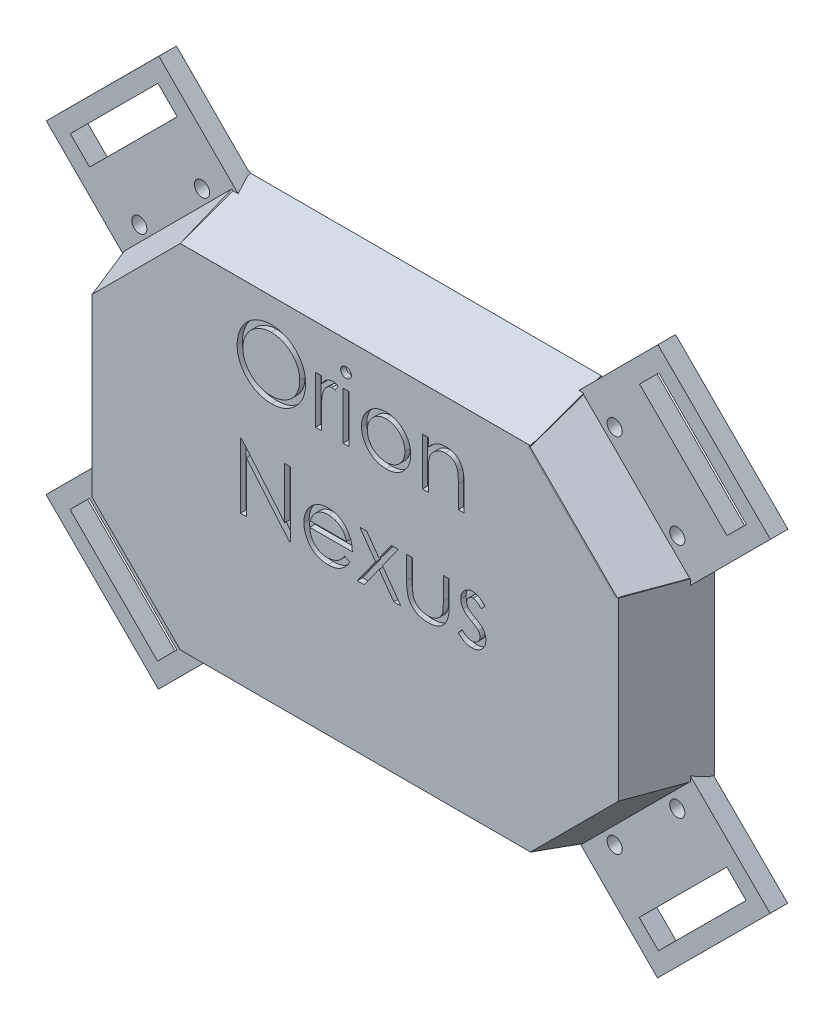
from build123d import *

# Parameters (mm, degrees)
SALIENTE_EXTRUIR1_DEPTH    = 3
CROQUIS2_W                 = 50.038273026
CROQUIS2_H                 = 34.567333251
SALIENTE_EXTRUIR2_DEPTH    = 3
CROQUIS3_W                 = 49.977474859
CROQUIS3_H                 = 25
SALIENTE_EXTRUIR3_DEPTH    = 3
CROQUIS4_W                 = 99.474594081
CROQUIS4_H                 = 31.186701584
SALIENTE_EXTRUIR4_DEPTH    = 3
CROQUIS5_W                 = 99.622543755
CROQUIS5_H                 = 50.308042672
SALIENTE_EXTRUIR5_DEPTH    = 3
SALIENTE_EXTRUIR6_DEPTH    = 3
SALIENTE_EXTRUIR7_DEPTH    = 3
SALIENTE_EXTRUIR8_DEPTH    = 3
SALIENTE_EXTRUIR9_DEPTH    = 3
CORTAR_EXTRUIR1_DEPTH      = 150.019877343
CORTAR_EXTRUIR1_DEPTH_BACK = 150.019877343
CROQUIS13_W                = 256.442645524
CROQUIS13_H                = 67.258268035
SALIENTE_EXTRUIR12_DEPTH   = 5
SALIENTE_EXTRUIR14_DEPTH   = 15
CROQUIS16_W                = 1.66025641
CROQUIS16_H                = 13.519230769
CORTAR_EXTRUIR2_DEPTH      = 1.5
CROQUIS17_R                = 2.15
CORTAR_EXTRUIR3_DEPTH      = 13


with BuildPart() as part:
    # Croquis1 → Saliente-Extruir1 (new body)
    with BuildSketch(Plane.XY):
        Polygon((-75, 25), (-100, 0), (-100, -50), (-75, -75), (24.508620324, -75), (49.508620324, -50), (49.508620324, 0), (24.508620324, 25), align=None)
    extrude(amount=SALIENTE_EXTRUIR1_DEPTH)

    # Croquis4 → Saliente-Extruir4 (add)
    with BuildSketch(Plane(origin=(0, -67.190848031, 24.455468699), x_dir=(1, 0, 0), z_dir=(0, 0.9396926207859093, -0.34202014332566644))):
        with Locations((-25.262702959, 38.425970686)):
            Rectangle(CROQUIS4_W, CROQUIS4_H)
    extrude(amount=SALIENTE_EXTRUIR4_DEPTH)

    # Croquis5 → Saliente-Extruir5 (add)
    with BuildSketch(Plane(origin=(0, 23.039736954, 8.385778456), x_dir=(-1, 0, 0), z_dir=(0, -0.9396926207859094, -0.3420201433256664))):
        with Locations((25.18894197, 30.896712272)):
            Rectangle(CROQUIS5_W, CROQUIS5_H)
    extrude(amount=SALIENTE_EXTRUIR5_DEPTH)



with BuildPart() as body_2:
    # Croquis2 → Saliente-Extruir2 (new body)
    with BuildSketch(Plane(origin=(-89.26640357, 0, 32.49031382), x_dir=(0, -1, 0), z_dir=(0.9396926207859105, 0, -0.3420201433256631))):
        with Locations((24.9777661, 48.666466498)):
            Rectangle(CROQUIS2_W, CROQUIS2_H)
    extrude(amount=SALIENTE_EXTRUIR2_DEPTH)


with BuildPart() as body_3:
    # Croquis3 → Saliente-Extruir3 (new body)
    with BuildSketch(Plane(origin=(44.681393319, 0, 16.262697194), x_dir=(0, 1, 0), z_dir=(-0.9396926207859093, 0, -0.34202014332566644))):
        with Locations((-25.005108127, 26.627091825)):
            Rectangle(CROQUIS3_W, CROQUIS3_H)
    extrude(amount=SALIENTE_EXTRUIR3_DEPTH)


with BuildPart() as part_1:
    add(part.part)

    add(body_3.part)  # Saliente-Extruir6 merges body 3
    # Croquis6 → Saliente-Extruir6 (add)
    with BuildSketch(Plane(origin=(23.835559633, 23.835559633, 8.285857797), x_dir=(-0.7071067811865475, 0.7071067811865477, 0), z_dir=(-0.6866661860794172, -0.686666186079417, -0.2387029488512759))):
        Polygon((-34.804780636, 5.258552546), (0.359891536, 5.258552546), (12.071286835, 54.417017189), (-47.231457067, 54.417017189), align=None)
    extrude(amount=SALIENTE_EXTRUIR6_DEPTH)


    add(body_2.part)  # Saliente-Extruir7 merges body 2
    # Croquis10 → Saliente-Extruir7 (add)
    with BuildSketch(Plane(origin=(-69.863867864, -69.863867864, 28.331140747), x_dir=(0.7071067811865479, -0.7071067811865472, 0), z_dir=(0.6797146636928673, 0.6797146636928679, -0.27563735581699333))):
        Polygon((0, 26.352162728), (-35.355339059, 26.351971429), (-44.361094067, 60.231991098), (6.839722093, 57.835860214), align=None)
    extrude(amount=SALIENTE_EXTRUIR7_DEPTH)

    # Croquis11 → Saliente-Extruir8 (add)
    with BuildSketch(Plane(origin=(47.260978809, -47.260978809, 16.924803418), x_dir=(0.707106781186548, 0.707106781186547, 0), z_dir=(-0.6854710962377859, 0.6854710962377868, -0.24547658227443042))):
        Polygon((-0.347457901, 14.364315254), (-35.818634684, 14.364315254), (-43.289922335, 45.059761782), (6.865850317, 43.729656232), align=None)
    extrude(amount=SALIENTE_EXTRUIR8_DEPTH)

    # Croquis12 → Saliente-Extruir9 (add)
    with BuildSketch(Plane(origin=(-46.763266662, 46.763266662, 18.963403117), x_dir=(-0.7071067811865475, -0.7071067811865476, 0), z_dir=(0.6797146636928684, -0.6797146636928683, -0.27563735581698984))):
        Polygon((35.355339059, 16.606719257), (70.710113301, 16.606719257), (79.338866447, 50.221138178), (27.719892373, 47.881125753), align=None)
    extrude(amount=SALIENTE_EXTRUIR9_DEPTH)

    # Croquis13 → Cortar-Extruir1 (cut, two sides: drawn at the far end of the back side and taken through both)
    with BuildSketch(Plane(origin=(0, 0, 0), x_dir=(1, 0, 0), z_dir=(0, 1, 0)).offset(-CORTAR_EXTRUIR1_DEPTH_BACK)):
        with Locations((-25.283398591, 50.639719858)):
            Rectangle(CROQUIS13_W, CROQUIS13_H)
    extrude(amount=CORTAR_EXTRUIR1_DEPTH + CORTAR_EXTRUIR1_DEPTH_BACK, mode=Mode.SUBTRACT)

    # Croquis14 → Saliente-Extruir12 (add)
    with BuildSketch(Plane(origin=(0, 0, -17.01058584), x_dir=(-1, 0, 0), z_dir=(0, 0, -1))):
        Polygon((-68.902544934, 12.248475653), (-54.691183552, -1.962885728), (-22.754069732, 29.974228091), (-36.965431114, 44.185589473), (-40.50096502, 40.650055567), (-65.367011028, 15.784009559), align=None)
        Polygon((-74.388919269, 17.734849988), (-68.902544934, 12.248475653), (-65.367011028, 15.784009559), (-70.853385363, 21.270383894), align=None)
        Polygon((-77.672153941, 21.01808466), (-74.388919269, 17.734849988), (-70.853385363, 21.270383894), (-45.987339355, 46.136429902), (-42.451805449, 49.671963808), (-45.735040121, 52.95519848), align=None)
        Polygon((-40.50096502, 40.650055567), (-36.965431114, 44.185589473), (-42.451805449, 49.671963808), (-45.987339355, 46.136429902), align=None)
        Polygon((-36.856121932, -94.165082735), (-22.667234726, -79.931282663), (-54.48883101, -48.107086911), (-68.800089251, -62.321910363), (-65.302545844, -65.808417737), (-40.397238185, -90.635140004), align=None)
        Polygon((-65.302545844, -65.808417737), (-68.800089251, -62.321910363), (-74.305047011, -67.78977359), (-70.7802439, -71.303454652), align=None)
        Polygon((-45.611862476, -102.948538307), (-42.333819988, -99.66011965), (-45.874936241, -96.13017692), (-70.7802439, -71.303454652), (-74.305047011, -67.78977359), (-77.599402642, -71.061930579), align=None)
        Polygon((-42.333819988, -99.66011965), (-36.856121932, -94.165082735), (-40.397238185, -90.635140004), (-45.874936241, -96.13017692), align=None)
        Polygon((124.85296704, -67.587015256), (119.364988054, -62.10224604), (115.83048852, -65.638814016), (121.318467506, -71.123583232), align=None)
        Polygon((128.137161989, -70.869289369), (124.85296704, -67.587015256), (121.318467506, -71.123583232), (96.459696427, -95.99690204), (92.925196893, -99.533470016), (96.209391843, -102.815744129), align=None)
        Polygon((119.364988054, -62.10224604), (105.563480713, -48.308810826), (73.635710567, -80.255265587), (87.437217907, -94.0487008), (90.971717441, -90.512132824), (115.83048852, -65.638814016), align=None)
        Polygon((90.971717441, -90.512132824), (87.437217907, -94.0487008), (92.925196893, -99.533470016), (96.459696427, -95.99690204), align=None)
        Polygon((115.7660652, 15.900627883), (90.868020967, 40.734634437), (87.327937452, 44.265612871), (73.454458012, 30.356358881), (105.432669276, -1.539604541), (119.306148716, 12.369649449), align=None)
        Polygon((90.868020967, 40.734634437), (96.347326208, 46.228068771), (92.807242692, 49.759047205), (87.327937452, 44.265612871), align=None)
        Polygon((92.807242692, 49.759047205), (96.347326208, 46.228068771), (121.245370441, 21.394062216), (124.785453956, 17.863083782), (128.064458239, 21.150543399), (96.086246975, 53.046506822), align=None)
        Polygon((124.785453956, 17.863083782), (121.245370441, 21.394062216), (115.7660652, 15.900627883), (119.306148716, 12.369649449), align=None)
    extrude(amount=-SALIENTE_EXTRUIR12_DEPTH)

    # Croquis15 → Saliente-Extruir14 (add)
    with BuildSketch(Plane(origin=(0, 0, 0), x_dir=(-1, 0, 0), z_dir=(0, 0, -1))):
        Polygon((-28.428709003, 2.96132495), (4.562729369, 2.96132495), (3.054172626, 1.46132495), (-26.928709003, 1.46132495), (-26.928709003, -51.538672285), (3.071290997, -51.538672285), (4.547743041, -53.023546743), (-28.428709003, -53.023546743), align=None)
        Polygon((13.391926591, 3.12417932), (46.647662879, 3.12417932), (46.647662879, -52.87582068), (13.383418383, -52.87582068), (9.883418383, -51.37582068), (44.883418383, -51.37582068), (44.883418383, 1.62417932), (14.883418383, 1.62417932), align=None)
    extrude(amount=SALIENTE_EXTRUIR14_DEPTH)

    # Croquis16 → Cortar-Extruir2 (cut)
    # profile 1 of 11: a face of its own
    with BuildSketch(Plane.XY.offset(3)):
        with BuildLine():
            add(Edge.make_bspline(
                [(-49.22416311, 17.984741554), (-48.881605979, 17.976065163), (-48.208795511, 17.959024015), (-47.219971051, 17.828577325), (-46.275968405, 17.602901692), (-45.369097671, 17.302340213), (-44.510206224, 16.901395605), (-43.692829221, 16.416774106), (-42.918911459, 15.843398539), (-42.198884156, 15.185701197), (-41.539983134, 14.47010294), (-40.959474878, 13.706433987), (-40.472965611, 12.899311746), (-40.073440736, 12.051161642), (-39.760005227, 11.163901811), (-39.543718854, 10.232802082), (-39.40556006, 9.263895292), (-39.389408094, 8.603039007), (-39.381214392, 8.267794438)],
                knots=[0, 0, 0, 0, 1.065120563, 2.091984664, 3.0946048, 4.079830382, 5.057816894, 6.036188127, 7.030412546, 8.04752943, 9.064399622, 10.05169764, 11.02544977, 11.989514704, 12.962713494, 13.945757189, 14.957906945, 16, 16, 16, 16], degree=3))
            add(Edge.make_bspline(
                [(-39.381214392, 8.267794438), (-39.389406893, 7.935019365), (-39.40555526, 7.279081142), (-39.543875942, 6.316322937), (-39.760806941, 5.390843542), (-40.070530063, 4.504187949), (-40.468150449, 3.655420826), (-40.957899211, 2.846775498), (-41.534788467, 2.077986864), (-42.191310394, 1.357477062), (-42.907001616, 0.696776145), (-43.674647312, 0.121062088), (-44.476983432, -0.374336856), (-45.324334746, -0.76962199), (-46.205463513, -1.085559284), (-47.128255792, -1.300966042), (-48.088387577, -1.439911843), (-48.743134312, -1.455866855), (-49.075925931, -1.463976395)],
                knots=[0, 0, 0, 0, 1.043624062, 2.057103931, 3.04512605, 4.022047818, 4.998200453, 5.980619268, 6.982898556, 8.009068085, 9.034988726, 10.034168286, 11.015286542, 11.987931943, 12.962482838, 13.94673481, 14.956375938, 16, 16, 16, 16], degree=3))
            add(Edge.make_bspline(
                [(-49.075925931, -1.463976395), (-49.41116876, -1.455786779), (-50.072021615, -1.439642865), (-51.042145945, -1.30125544), (-51.973899734, -1.084851405), (-52.864618448, -0.775587243), (-53.71479879, -0.375896166), (-54.526103513, 0.111469838), (-55.295276148, 0.689764727), (-56.015939665, 1.346073764), (-56.675328284, 2.060551967), (-57.25019927, 2.826104459), (-57.737674869, 3.627711872), (-58.136023912, 4.467598785), (-58.451393197, 5.341704983), (-58.666547236, 6.255861221), (-58.805751554, 7.204855751), (-58.821792885, 7.850996785), (-58.829932341, 8.178852131)],
                knots=[0, 0, 0, 0, 1.053102029, 2.075944431, 3.073151272, 4.055350789, 5.033113405, 6.020478099, 7.024410459, 8.052272461, 9.079885166, 10.07527673, 11.055994387, 12.023226415, 12.992069828, 13.970394897, 14.97016774, 16, 16, 16, 16], degree=3))
            add(Edge.make_bspline(
                [(-58.829932341, 8.178852131), (-58.82710641, 8.398910525), (-58.8214902, 8.836251177), (-58.753876968, 9.485688921), (-58.655765119, 10.124682398), (-58.51515501, 10.751414551), (-58.331256199, 11.364351185), (-58.114266911, 11.967719503), (-57.849242014, 12.5554049), (-57.549644303, 13.130191399), (-57.215260461, 13.683118901), (-56.845917213, 14.205768126), (-56.454587409, 14.702524823), (-56.0255809, 15.160516129), (-55.573036832, 15.593065456), (-55.089613976, 15.993525532), (-54.578262113, 16.365507415), (-54.036780963, 16.700729218), (-53.478512939, 17.003913215), (-52.903021399, 17.264085856), (-52.318122378, 17.487386467), (-51.721076382, 17.668373686), (-51.113468872, 17.811257305), (-50.493973725, 17.908553317), (-49.863084472, 17.976338998), (-49.438053215, 17.981928651), (-49.22416311, 17.984741554)],
                knots=[0, 0, 0, 0, 1.037015668, 2.060948919, 3.074880161, 4.083647147, 5.086022904, 6.090072063, 7.104153813, 8.122640571, 9.144368836, 10.147691507, 11.138137339, 12.123020368, 13.103399296, 14.087645067, 15.080126199, 16.082011238, 17.087798457, 18.072939717, 19.057185487, 20.037253025, 21.01195951, 21.997135196, 22.992090687, 24, 24, 24, 24], degree=3))
        make_face()
        with BuildLine():
            add(Edge.make_bspline(
                [(-49.142632662, 16.087305656), (-49.318195725, 16.085165522), (-49.667643456, 16.080905713), (-50.187147433, 16.024794074), (-50.699819083, 15.944821804), (-51.205764283, 15.830748051), (-51.702866099, 15.675326629), (-52.195758116, 15.496453257), (-52.679945687, 15.27857035), (-53.153830364, 15.032400341), (-53.613238618, 14.759927474), (-54.046734326, 14.458790991), (-54.45543973, 14.136052919), (-54.838354139, 13.790960064), (-55.194353192, 13.421755026), (-55.530443757, 13.034035006), (-55.833154403, 12.616717868), (-56.110578166, 12.181120003), (-56.35883675, 11.727808788), (-56.579596483, 11.261556659), (-56.760177672, 10.778560315), (-56.907450232, 10.284059768), (-57.029549232, 9.778838195), (-57.106899974, 9.259062994), (-57.16362816, 8.727345973), (-57.167644486, 8.368013316), (-57.169675931, 8.18626399)],
                knots=[0, 0, 0, 0, 1.008559885, 2.007477868, 2.99961109, 3.989939068, 4.984837346, 5.991145699, 7.001802488, 8.033829008, 9.059044045, 10.069351652, 11.065060232, 12.050310815, 13.029377138, 14.011219647, 14.996725999, 15.989392538, 16.977580475, 17.965360261, 18.951710183, 19.937753436, 20.929683414, 21.935841486, 22.955955122, 24, 24, 24, 24], degree=3))
            add(Edge.make_bspline(
                [(-57.169675931, 8.18626399), (-57.162937375, 7.919006537), (-57.14968055, 7.393228448), (-57.033619108, 6.622739688), (-56.854845815, 5.882273031), (-56.591314021, 5.175880082), (-56.261746486, 4.497488873), (-55.854604352, 3.853117462), (-55.372234899, 3.242591698), (-54.824299116, 2.670173848), (-54.225307667, 2.147703168), (-53.589263237, 1.68909658), (-52.922979883, 1.301070973), (-52.224720098, 0.984958448), (-51.498211677, 0.734469834), (-50.738773193, 0.562797069), (-49.951463621, 0.449812519), (-49.414801586, 0.438962238), (-49.142632662, 0.433459502)],
                knots=[0, 0, 0, 0, 1.032063989, 2.030389145, 3.003944642, 3.970395727, 4.937377036, 5.913328081, 6.909231446, 7.93887556, 8.970685674, 9.976071282, 10.964166581, 11.944589148, 12.933237628, 13.927779006, 14.949070134, 16, 16, 16, 16], degree=3))
            add(Edge.make_bspline(
                [(-49.142632662, 0.433459502), (-48.959696724, 0.435972883), (-48.596879818, 0.44095767), (-48.057232057, 0.491164962), (-47.527306366, 0.571676272), (-47.00784603, 0.687595452), (-46.499440598, 0.832673543), (-45.999968067, 1.005028676), (-45.514748533, 1.220057896), (-45.037660819, 1.457639926), (-44.58099497, 1.728480758), (-44.145052871, 2.019396692), (-43.740822691, 2.341659402), (-43.358194742, 2.681624982), (-43.000734101, 3.046148178), (-42.670858041, 3.434755065), (-42.369677343, 3.849898539), (-42.092358925, 4.284835683), (-41.84497025, 4.739387305), (-41.629423584, 5.207329888), (-41.4465584, 5.687511181), (-41.298936303, 6.180623773), (-41.183256006, 6.685731116), (-41.103547858, 7.203509529), (-41.047791825, 7.732923197), (-41.043589274, 8.090997864), (-41.041470803, 8.271500368)],
                knots=[0, 0, 0, 0, 1.047197238, 2.076906641, 3.100256066, 4.114471768, 5.12198147, 6.126382909, 7.136867548, 8.15857795, 9.17633901, 10.174870724, 11.156907918, 12.133735059, 13.104061851, 14.077631395, 15.04955518, 16.038496417, 17.029181396, 18.010275684, 18.986308667, 19.968651475, 20.955262928, 21.950658345, 22.966943676, 24, 24, 24, 24], degree=3))
            add(Edge.make_bspline(
                [(-41.041470803, 8.271500368), (-41.043590971, 8.450768033), (-41.047796716, 8.80637847), (-41.103521225, 9.332099938), (-41.183340217, 9.846152627), (-41.298371674, 10.346518443), (-41.446636772, 10.833324933), (-41.629455518, 11.306114885), (-41.845034958, 11.766649631), (-42.092449859, 12.213790915), (-42.370562068, 12.642857387), (-42.674460212, 13.053041567), (-43.009391338, 13.436640343), (-43.36578604, 13.803123726), (-43.752546434, 14.144675428), (-44.16792056, 14.461408751), (-44.606865714, 14.760967487), (-45.071623958, 15.031202599), (-45.551270571, 15.280763544), (-46.043444349, 15.494575989), (-46.54256959, 15.676257191), (-47.047377041, 15.831218292), (-47.56211564, 15.944375023), (-48.083307307, 16.024866144), (-48.61023096, 16.080886184), (-48.964602264, 16.085159042), (-49.142632662, 16.087305656)],
                knots=[0, 0, 0, 0, 1.02996197, 2.043119294, 3.035359645, 4.018872909, 4.991431989, 5.957985074, 6.929999688, 7.912076566, 8.892894881, 9.867085534, 10.843653904, 11.817741046, 12.803660682, 13.806313499, 14.818574707, 15.856120519, 16.894564902, 17.924820532, 18.937903209, 19.946497019, 20.957711757, 21.963978472, 22.977135795, 24, 24, 24, 24], degree=3))
        make_face(mode=Mode.SUBTRACT)
    # profile 2 of 11: a face of its own
    with BuildSketch(Plane.XY.offset(3)):
        with BuildLine():
            Line((-36.535060546, 12.529613348), (-34.874804136, 12.529613348))
            Line((-34.874804136, 12.529613348), (-34.874804136, 10.539529214))
            add(Edge.make_bspline(
                [(-34.874804136, 10.539529214), (-34.752234982, 10.724824306), (-34.517822429, 11.079199731), (-34.128196945, 11.547880322), (-33.729107908, 11.935931283), (-33.318644776, 12.245164168), (-32.893789105, 12.476747796), (-32.463865217, 12.64638241), (-32.022109162, 12.746691076), (-31.725253277, 12.760083273), (-31.576526892, 12.766792836)],
                knots=[0, 0, 0, 0, 1.2804753, 2.448899062, 3.506932113, 4.484331642, 5.4025378, 6.288909075, 7.142734305, 8, 8, 8, 8], degree=3))
            add(Edge.make_bspline(
                [(-31.576526892, 12.766792836), (-31.461159167, 12.760500052), (-31.223782573, 12.747552241), (-30.864446027, 12.65658074), (-30.494216353, 12.511339763), (-30.255606592, 12.374755729), (-30.131214392, 12.30355165)],
                knots=[0, 0, 0, 0, 0.901110191, 1.854092781, 2.881294221, 4, 4, 4, 4], degree=3))
            Line((-30.131214392, 12.30355165), (-31.042873046, 10.865651009))
            add(Edge.make_bspline(
                [(-31.042873046, 10.865651009), (-31.122735015, 10.90127813), (-31.27432832, 10.968905225), (-31.496088171, 11.048941565), (-31.700546665, 11.096068548), (-31.830805473, 11.103208055), (-31.891530899, 11.106536425)],
                knots=[0, 0, 0, 0, 1.180555205, 2.24091978, 3.179933427, 4, 4, 4, 4], degree=3))
            add(Edge.make_bspline(
                [(-31.891530899, 11.106536425), (-32.024761204, 11.097656228), (-32.296512409, 11.079543199), (-32.695501905, 10.937152358), (-33.082665706, 10.707090375), (-33.390144493, 10.451943069), (-33.628224972, 10.205904711), (-33.798109021, 9.991048869), (-33.953946398, 9.750133245), (-34.102846134, 9.487276345), (-34.238510832, 9.197990016), (-34.36512837, 8.885164459), (-34.479610931, 8.54843735), (-34.544890793, 8.313844029), (-34.578329777, 8.193675848)],
                knots=[0, 0, 0, 0, 1.125678352, 2.296057538, 3.5422874, 4.923748041, 5.663163013, 6.437101912, 7.23742474, 8.08941207, 8.991984279, 9.93940061, 10.944477711, 12, 12, 12, 12], degree=3))
            add(Edge.make_bspline(
                [(-34.578329777, 8.193675848), (-34.603343856, 8.086496502), (-34.658748141, 7.849102395), (-34.712617698, 7.450831622), (-34.765842293, 6.980277997), (-34.80335299, 6.43613172), (-34.838122641, 5.819751659), (-34.857733076, 5.130198804), (-34.87413539, 4.366765377), (-34.874574458, 3.833043795), (-34.874804136, 3.553852131)],
                knots=[0, 0, 0, 0, 0.566838948, 1.255505196, 2.06880316, 3.007127437, 4.065329342, 5.249902469, 6.561414163, 8, 8, 8, 8], degree=3))
            Line((-34.874804136, 3.553852131), (-34.874804136, -0.989617421))
            Line((-34.874804136, -0.989617421), (-36.535060546, -0.989617421))
            Line((-36.535060546, -0.989617421), (-36.535060546, 12.529613348))
        make_face()
    # profile 3 of 11: a face of its own
    with BuildSketch(Plane.XY.offset(3)):
        with BuildLine():
            add(Edge.make_bspline(
                [(-27.885421123, 18.221921041), (-27.782395597, 18.21714195), (-27.580651829, 18.207783571), (-27.288915986, 18.127644335), (-27.023271779, 17.991803141), (-26.787646619, 17.809553399), (-26.585458075, 17.595220626), (-26.443902892, 17.345412651), (-26.352923084, 17.075531274), (-26.341936435, 16.887280089), (-26.336342597, 16.791432259)],
                knots=[0, 0, 0, 0, 1.055194115, 2.066272739, 3.074728998, 4.095836921, 5.109056067, 6.073838105, 7.019297344, 8, 8, 8, 8], degree=3))
            add(Edge.make_bspline(
                [(-26.336342597, 16.791432259), (-26.342062585, 16.698072521), (-26.353370324, 16.513511367), (-26.443832619, 16.248308729), (-26.586664447, 16.001971802), (-26.787516969, 15.788055191), (-27.023306134, 15.605906199), (-27.288906859, 15.470038294), (-27.58065423, 15.389906139), (-27.782396408, 15.380546784), (-27.885421123, 15.375767195)],
                knots=[0, 0, 0, 0, 0.96129708, 1.900370562, 2.859976407, 3.87933698, 4.906634145, 5.921202961, 6.938410037, 8, 8, 8, 8], degree=3))
            add(Edge.make_bspline(
                [(-27.885421123, 15.375767195), (-27.98726772, 15.380364287), (-28.185498816, 15.389311927), (-28.472866411, 15.471610593), (-28.736245569, 15.605952693), (-28.972330267, 15.786862529), (-29.169118431, 16.003285557), (-29.312352437, 16.248158396), (-29.402605807, 16.513549642), (-29.413941701, 16.698085378), (-29.419675931, 16.791432259)],
                knots=[0, 0, 0, 0, 1.054934014, 2.053291228, 3.073705704, 4.106921865, 5.123545215, 6.088680038, 7.033164197, 8, 8, 8, 8], degree=3))
            add(Edge.make_bspline(
                [(-29.419675931, 16.791432259), (-29.41406733, 16.88726675), (-29.403051684, 17.075491736), (-29.312284785, 17.345565482), (-29.170311515, 17.593896277), (-28.972199965, 17.810745345), (-28.736280247, 17.991756929), (-28.472857451, 18.126072117), (-28.185501183, 18.208377768), (-27.987268524, 18.217324444), (-27.885421123, 18.221921041)],
                knots=[0, 0, 0, 0, 0.98631895, 1.937192651, 2.907499808, 3.917963147, 4.944918757, 5.95915025, 6.951458133, 8, 8, 8, 8], degree=3))
        make_face()
    # profile 4 of 11: a face of its own
    with BuildSketch(Plane.XY.offset(3)):
        with Locations((-27.878009264, 5.769997964)):
            Rectangle(CROQUIS16_W, CROQUIS16_H)
    # profile 5 of 11: a face of its own
    with BuildSketch(Plane.XY.offset(3)):
        with BuildLine():
            add(Edge.make_bspline(
                [(-16.485982021, 12.766792836), (-16.232313864, 12.761391411), (-15.734932603, 12.750800537), (-15.006519492, 12.637607148), (-14.311209487, 12.464513936), (-13.646339614, 12.225221393), (-13.02042491, 11.904473941), (-12.424348334, 11.521739116), (-11.859744144, 11.068316836), (-11.521336704, 10.717567046), (-11.349563751, 10.539529214)],
                knots=[0, 0, 0, 0, 1.054011418, 2.066658804, 3.057071809, 4.030435133, 4.997543892, 5.974964718, 6.972108034, 8, 8, 8, 8], degree=3))
            add(Edge.make_bspline(
                [(-11.349563751, 10.539529214), (-11.201659137, 10.369255289), (-10.90871227, 10.032002709), (-10.533079185, 9.485165897), (-10.20947951, 8.918853937), (-9.950146716, 8.325546639), (-9.745668734, 7.710423377), (-9.600492911, 7.07136989), (-9.51414054, 6.409797483), (-9.502496286, 5.960491482), (-9.496599008, 5.732938669)],
                knots=[0, 0, 0, 0, 1.025258237, 2.030674902, 3.01204498, 3.988269485, 4.97094183, 5.956517959, 6.965070386, 8, 8, 8, 8], degree=3))
            add(Edge.make_bspline(
                [(-9.496599008, 5.732938669), (-9.501786076, 5.504066936), (-9.512035966, 5.051805717), (-9.608995081, 4.385703355), (-9.759802249, 3.739816435), (-9.97562768, 3.116849053), (-10.252377686, 2.514896966), (-10.590085606, 1.936589348), (-10.991121296, 1.380785215), (-11.445713851, 0.85220407), (-11.94813091, 0.365039792), (-12.493173409, -0.05955249), (-13.070130444, -0.423323405), (-13.686673883, -0.716344459), (-14.337173456, -0.947381446), (-15.023032245, -1.109652961), (-15.743184759, -1.207764719), (-16.234900072, -1.220363606), (-16.485982021, -1.226796908)],
                knots=[0, 0, 0, 0, 0.998656419, 1.973391657, 2.932242238, 3.890759089, 4.846373663, 5.82037756, 6.809684879, 7.83454468, 8.860553229, 9.859544525, 10.845671541, 11.83227036, 12.833544569, 13.85385346, 14.904124723, 16, 16, 16, 16], degree=3))
            add(Edge.make_bspline(
                [(-16.485982021, -1.226796908), (-16.738294109, -1.220342014), (-17.232460082, -1.207699777), (-17.955154558, -1.11003414), (-18.642242544, -0.947456232), (-19.293593707, -0.715585199), (-19.912787898, -0.423314039), (-20.493087954, -0.060652251), (-21.038573222, 0.365165712), (-21.541096568, 0.852169951), (-21.995660624, 1.380794006), (-22.396703669, 1.936587066), (-22.734409678, 2.51489756), (-23.011160184, 3.116848895), (-23.226985481, 3.739816477), (-23.377792685, 4.385703343), (-23.474751791, 5.05180572), (-23.485001682, 5.504066937), (-23.490188751, 5.732938669)],
                knots=[0, 0, 0, 0, 1.099876186, 2.154163076, 3.173186993, 4.173200201, 5.163417411, 6.152872554, 7.150605724, 8.17532212, 9.198891216, 10.186952605, 11.159729845, 12.11414092, 13.071450619, 14.029093627, 15.002601286, 16, 16, 16, 16], degree=3))
            add(Edge.make_bspline(
                [(-23.490188751, 5.732938669), (-23.484251254, 5.959254697), (-23.472496029, 6.407321539), (-23.386230481, 7.067650288), (-23.241620968, 7.705622201), (-23.036897873, 8.318371146), (-22.775174721, 8.909078451), (-22.456122199, 9.4767897), (-22.076657427, 10.021153788), (-21.784875683, 10.357970497), (-21.637224008, 10.528411425)],
                knots=[0, 0, 0, 0, 1.031353054, 2.041901799, 3.029428768, 4.008703097, 4.981709435, 5.96992636, 6.972712378, 8, 8, 8, 8], degree=3))
            add(Edge.make_bspline(
                [(-21.637224008, 10.528411425), (-21.465710027, 10.707993247), (-21.128397603, 11.061172499), (-20.5609829, 11.513272983), (-19.966372702, 11.903972231), (-19.33354095, 12.218346512), (-18.669217272, 12.465921535), (-17.970344133, 12.638053543), (-17.239459266, 12.750392705), (-16.739644126, 12.761271645), (-16.485982021, 12.766792836)],
                knots=[0, 0, 0, 0, 1.027980169, 2.021703884, 2.998553061, 3.971491411, 4.943284454, 5.930300938, 6.949603206, 8, 8, 8, 8], degree=3))
        make_face()
        with BuildLine():
            add(Edge.make_bspline(
                [(-16.493393879, 11.106536425), (-16.672778396, 11.101437869), (-17.026916648, 11.091372376), (-17.548191596, 11.014814594), (-18.050018124, 10.893520644), (-18.5333483, 10.721184918), (-18.996552211, 10.498662166), (-19.440073338, 10.225346548), (-19.865216235, 9.904858064), (-20.263664284, 9.537698228), (-20.62934222, 9.136623543), (-20.949011525, 8.709282217), (-21.220829944, 8.262605816), (-21.447270784, 7.796129842), (-21.615923064, 7.305127083), (-21.73840904, 6.795158032), (-21.814894597, 6.265183688), (-21.824865455, 5.90490402), (-21.829932341, 5.721820881)],
                knots=[0, 0, 0, 0, 1.021534396, 2.016698045, 2.994645724, 3.958388632, 4.93408049, 5.916473867, 6.921342795, 7.962252576, 8.998418191, 10.008913653, 10.997312074, 11.973003931, 12.956656626, 13.948281152, 14.957379055, 16, 16, 16, 16], degree=3))
            add(Edge.make_bspline(
                [(-21.829932341, 5.721820881), (-21.82143913, 5.485274451), (-21.804581695, 5.015774022), (-21.667495446, 4.324343802), (-21.438167966, 3.660554013), (-21.128492345, 3.028295972), (-20.740488046, 2.443313931), (-20.283342122, 1.921764657), (-19.761960849, 1.471496796), (-19.182559348, 1.097898041), (-18.556972239, 0.801053618), (-17.894903113, 0.590687604), (-17.20437373, 0.45393723), (-16.732461294, 0.440345151), (-16.493393879, 0.433459502)],
                knots=[0, 0, 0, 0, 1.016792936, 2.018143844, 3.017858371, 4.030088057, 5.03801393, 6.028138512, 7.003788237, 7.991172063, 8.984598303, 9.972568034, 10.972917682, 12, 12, 12, 12], degree=3))
            add(Edge.make_bspline(
                [(-16.493393879, 0.433459502), (-16.254340215, 0.440385269), (-15.782454922, 0.454056541), (-15.092884987, 0.589998874), (-14.432625422, 0.801975367), (-13.807688088, 1.09756419), (-13.228550327, 1.472915525), (-12.703419257, 1.91922209), (-12.250176598, 2.444695304), (-11.862556115, 3.029070814), (-11.547809046, 3.659573818), (-11.31955498, 4.324466314), (-11.182139169, 5.015742821), (-11.165326217, 5.485263998), (-11.156855418, 5.721820881)],
                knots=[0, 0, 0, 0, 1.02726834, 2.027799167, 3.010890988, 4.004497153, 4.992059811, 5.971914811, 6.958719428, 7.966827853, 8.981595046, 9.981490638, 10.983022906, 12, 12, 12, 12], degree=3))
            add(Edge.make_bspline(
                [(-11.156855418, 5.721820881), (-11.16192056, 5.904905114), (-11.171887985, 6.265186936), (-11.248398511, 6.795145619), (-11.370792078, 7.30517263), (-11.539784912, 7.79596179), (-11.765241842, 8.263813598), (-12.042302034, 8.707970727), (-12.360666025, 9.138103899), (-12.730756522, 9.536401715), (-13.128788662, 9.905001194), (-13.554103864, 10.225470823), (-13.996967322, 10.497460971), (-14.458825545, 10.723088243), (-14.942217688, 10.891952756), (-15.443341085, 11.015514951), (-15.962391937, 11.091048847), (-16.315261166, 11.101340881), (-16.493393879, 11.106536425)],
                knots=[0, 0, 0, 0, 1.042956736, 2.052379634, 3.044323526, 4.02829302, 5.004299113, 5.996692471, 7.007513377, 8.048758398, 9.090003419, 10.095195979, 11.07790575, 12.047570684, 13.018257071, 13.989683339, 14.985167495, 16, 16, 16, 16], degree=3))
        make_face(mode=Mode.SUBTRACT)
    # profile 6 of 11: a face of its own
    with BuildSketch(Plane.XY.offset(3)):
        with BuildLine():
            Line((-6.176086187, 12.529613348), (-4.515829777, 12.529613348))
            Line((-4.515829777, 12.529613348), (-4.515829777, 10.091111746))
            add(Edge.make_bspline(
                [(-4.515829777, 10.091111746), (-4.33855942, 10.312280424), (-3.994560107, 10.741465959), (-3.421671488, 11.305560425), (-2.816225158, 11.770413757), (-2.181928854, 12.140962382), (-1.517921515, 12.420294549), (-0.828250659, 12.622028756), (-0.108787213, 12.742991422), (0.380481953, 12.758796925), (0.628000351, 12.766792836)],
                knots=[0, 0, 0, 0, 1.12780773, 2.188550248, 3.19190651, 4.159438251, 5.104880172, 6.052711206, 7.014878035, 8, 8, 8, 8], degree=3))
            add(Edge.make_bspline(
                [(0.628000351, 12.766792836), (0.87817656, 12.757568231), (1.367831747, 12.739513455), (2.080758643, 12.596710945), (2.746618009, 12.352800311), (3.363035661, 12.018679367), (3.918708075, 11.603188008), (4.406710861, 11.119134018), (4.810345169, 10.562357579), (5.080959802, 10.045820896), (5.25922394, 9.587608697), (5.371452009, 9.19516159), (5.466758626, 8.757937076), (5.54938358, 8.277256391), (5.605291171, 7.749751671), (5.64938614, 7.177585299), (5.68098781, 6.560942609), (5.682241618, 6.13445615), (5.682888172, 5.914529214)],
                knots=[0, 0, 0, 0, 1.235846778, 2.418850247, 3.575807741, 4.728682307, 5.871620074, 6.994088408, 8.11269785, 9.256955736, 9.865816715, 10.540099792, 11.271859618, 12.076849838, 12.949306005, 13.892391288, 14.913166135, 16, 16, 16, 16], degree=3))
            Line((5.682888172, 5.914529214), (5.682888172, -0.989617421))
            Line((5.682888172, -0.989617421), (4.022631762, -0.989617421))
            Line((4.022631762, -0.989617421), (4.022631762, 5.369757579))
            add(Edge.make_bspline(
                [(4.022631762, 5.369757579), (4.021610519, 5.553819074), (4.019657056, 5.905897388), (4.013495781, 6.409990796), (3.998643946, 6.867134139), (3.977774292, 7.27623451), (3.947227988, 7.636899075), (3.915394079, 7.949862394), (3.876464916, 8.214727119), (3.841775232, 8.374171126), (3.826217499, 8.445679054)],
                knots=[0, 0, 0, 0, 1.430800155, 2.736877192, 3.918605307, 4.986035426, 5.920637409, 6.731861385, 7.431261377, 8, 8, 8, 8], degree=3))
            add(Edge.make_bspline(
                [(3.826217499, 8.445679054), (3.770053975, 8.655581031), (3.661956569, 9.059577396), (3.394848372, 9.607570402), (3.057544845, 10.073760824), (2.64579907, 10.455266352), (2.163588241, 10.752169346), (1.612250487, 10.958174536), (0.997106243, 11.08702053), (0.564447363, 11.099849656), (0.338937851, 11.106536425)],
                knots=[0, 0, 0, 0, 1.084156227, 2.086665306, 3.027808233, 3.945421172, 4.874247719, 5.839848303, 6.874090471, 8, 8, 8, 8], degree=3))
            add(Edge.make_bspline(
                [(0.338937851, 11.106536425), (0.205380095, 11.104020401), (-0.058927254, 11.099041253), (-0.450862819, 11.049084392), (-0.831033449, 10.967375412), (-1.203254554, 10.857069757), (-1.560081464, 10.705569191), (-1.912978431, 10.533628234), (-2.248657042, 10.319301971), (-2.574274998, 10.080437258), (-2.877214124, 9.815732877), (-3.159092484, 9.536411894), (-3.410364877, 9.238955132), (-3.638013589, 8.928155409), (-3.834527267, 8.599744265), (-4.006065018, 8.256890074), (-4.151610833, 7.899141573), (-4.223933637, 7.650844821), (-4.260120642, 7.526608541)],
                knots=[0, 0, 0, 0, 1.023777757, 2.026029729, 3.023749952, 4.003683103, 4.997618607, 5.993177895, 7.010360494, 8.046726602, 9.087585522, 10.09234134, 11.086953743, 12.070360549, 13.043493632, 14.017870808, 15.008233677, 16, 16, 16, 16], degree=3))
            add(Edge.make_bspline(
                [(-4.260120642, 7.526608541), (-4.280944499, 7.435402468), (-4.326276946, 7.236851617), (-4.375239468, 6.911016829), (-4.419679509, 6.534092675), (-4.456874862, 6.106519), (-4.479632063, 5.626798802), (-4.504445304, 5.096980803), (-4.513478912, 4.514952364), (-4.515024212, 4.10974056), (-4.515829777, 3.898503573)],
                knots=[0, 0, 0, 0, 0.615963638, 1.340920617, 2.168419149, 3.115676021, 4.16674242, 5.331190069, 6.6087489, 8, 8, 8, 8], degree=3))
            Line((-4.515829777, 3.898503573), (-4.515829777, -0.989617421))
            Line((-4.515829777, -0.989617421), (-6.176086187, -0.989617421))
            Line((-6.176086187, -0.989617421), (-6.176086187, 12.529613348))
        make_face()
    # profile 7 of 11: a face of its own
    with BuildSketch(Plane.XY.offset(3)):
        Polygon((-57.881214392, -32.822950754), (-57.881214392, -14.322950754), (-57.532857021, -14.322950754), (-45.310701572, -28.883547709), (-45.310701572, -14.322950754), (-43.650445162, -14.322950754), (-43.650445162, -32.822950754), (-44.028449969, -32.822950754), (-56.220957982, -18.295707164), (-56.220957982, -32.822950754), align=None)
    # profile 8 of 11: a face of its own
    with BuildSketch(Plane.XY.offset(3)):
        with BuildLine():
            Line((-28.285661508, -28.553719985), (-26.810701572, -29.328259248))
            add(Edge.make_bspline(
                [(-26.810701572, -29.328259248), (-26.928237861, -29.536745427), (-27.156916934, -29.942376971), (-27.55017803, -30.499659662), (-27.962421843, -31.000997588), (-28.412257102, -31.43299719), (-28.886225405, -31.809611653), (-29.386955152, -32.139111584), (-29.917053188, -32.419880906), (-30.476544591, -32.656429981), (-31.070127932, -32.838308736), (-31.699241662, -32.966773904), (-32.365090995, -33.046182609), (-32.821492231, -33.055406925), (-33.055192758, -33.060130241)],
                knots=[0, 0, 0, 0, 1.120438281, 2.179929193, 3.190490725, 4.156257408, 5.095198341, 6.022838206, 6.959905092, 7.901321166, 8.864066838, 9.862729781, 10.905609505, 12, 12, 12, 12], degree=3))
            add(Edge.make_bspline(
                [(-33.055192758, -33.060130241), (-33.31494321, -33.0540666), (-33.821641093, -33.042238193), (-34.559208328, -32.940263738), (-35.253642397, -32.773909842), (-35.904904257, -32.541520552), (-36.511399021, -32.237976124), (-37.074332111, -31.868190292), (-37.59666389, -31.43406266), (-38.06193471, -30.931832887), (-38.480795233, -30.394371113), (-38.850403139, -29.834318581), (-39.159392417, -29.253084394), (-39.410741928, -28.654368767), (-39.613739072, -28.04194533), (-39.75522022, -27.410241858), (-39.836777459, -26.760968056), (-39.849275243, -26.321739281), (-39.855573367, -26.100394664)],
                knots=[0, 0, 0, 0, 1.145258523, 2.234067595, 3.276747158, 4.290159414, 5.277019952, 6.260822364, 7.254936242, 8.264827045, 9.274100331, 10.257902744, 11.220704747, 12.172965371, 13.118907548, 14.062713208, 15.023725156, 16, 16, 16, 16], degree=3))
            add(Edge.make_bspline(
                [(-39.855573367, -26.100394664), (-39.849975048, -25.892693418), (-39.83887992, -25.481056976), (-39.768945758, -24.871796241), (-39.645004781, -24.279645849), (-39.474929926, -23.704113766), (-39.25530191, -23.14616363), (-38.986617323, -22.605455865), (-38.668457612, -22.08256584), (-38.422816336, -21.752720705), (-38.299082982, -21.586572549)],
                knots=[0, 0, 0, 0, 1.024358464, 2.0301432, 3.019427413, 4.004406732, 4.986367066, 5.972626655, 6.978780325, 8, 8, 8, 8], degree=3))
            add(Edge.make_bspline(
                [(-38.299082982, -21.586572549), (-38.13148523, -21.386408521), (-37.801598798, -20.992421155), (-37.243658063, -20.474747147), (-36.639499882, -20.041087192), (-35.996695573, -19.681620901), (-35.30777421, -19.408488767), (-34.581996529, -19.20494869), (-33.81109843, -19.090893489), (-33.28408512, -19.074783511), (-33.014427533, -19.066540498)],
                knots=[0, 0, 0, 0, 1.030682036, 2.02871468, 2.997146059, 3.962720338, 4.930598197, 5.918074684, 6.934738563, 8, 8, 8, 8], degree=3))
            add(Edge.make_bspline(
                [(-33.014427533, -19.066540498), (-32.737204477, -19.073697613), (-32.193356034, -19.087738242), (-31.400329108, -19.217906005), (-30.649965321, -19.42432665), (-29.942564941, -19.715853829), (-29.278056249, -20.091982888), (-28.660758558, -20.557875479), (-28.080114849, -21.099228226), (-27.742312361, -21.515548047), (-27.570417117, -21.727397869)],
                knots=[0, 0, 0, 0, 1.056321875, 2.072262726, 3.055038591, 4.01806755, 4.982017516, 5.957941055, 6.960871419, 8, 8, 8, 8], degree=3))
            add(Edge.make_bspline(
                [(-27.570417117, -21.727397869), (-27.453460443, -21.887045371), (-27.220325593, -22.205277713), (-26.928305208, -22.7241824), (-26.67481612, -23.267081256), (-26.47219904, -23.842749969), (-26.308133105, -24.44436775), (-26.189432778, -25.076235487), (-26.119821937, -25.738165018), (-26.106138822, -26.189176811), (-26.09916311, -26.4191046)],
                knots=[0, 0, 0, 0, 0.94817472, 1.890038105, 2.849395472, 3.817997239, 4.812318967, 5.836947057, 6.897266129, 8, 8, 8, 8], degree=3))
            Line((-26.09916311, -26.4191046), (-38.195316956, -26.4191046))
            add(Edge.make_bspline(
                [(-38.195316956, -26.4191046), (-38.187179037, -26.597235626), (-38.171176146, -26.947523102), (-38.096567532, -27.460082956), (-37.978966871, -27.94834205), (-37.813687539, -28.408638129), (-37.613534215, -28.846983089), (-37.368352569, -29.260125284), (-37.075843498, -29.646182915), (-36.749579087, -30.008609213), (-36.386413011, -30.331358951), (-36.004347062, -30.620232625), (-35.597909647, -30.862347922), (-35.170305491, -31.058870197), (-34.722226056, -31.212717867), (-34.253530167, -31.317733491), (-33.765140123, -31.388071056), (-33.432215529, -31.395892143), (-33.262724809, -31.399873831)],
                knots=[0, 0, 0, 0, 1.094153842, 2.151609401, 3.174256925, 4.172055639, 5.149267565, 6.128595816, 7.11444997, 8.118368179, 9.117203808, 10.09244225, 11.054858984, 12.015122123, 12.976791628, 13.957293641, 14.960065497, 16, 16, 16, 16], degree=3))
            add(Edge.make_bspline(
                [(-33.262724809, -31.399873831), (-33.0970116, -31.396659817), (-32.768204805, -31.390282597), (-32.278531702, -31.328271068), (-31.7967942, -31.227999611), (-31.324986146, -31.091152521), (-30.872683103, -30.924246303), (-30.453813767, -30.722845484), (-30.06858977, -30.500053965), (-29.708542947, -30.245231397), (-29.359310553, -29.93333098), (-29.012871697, -29.544113598), (-28.641409386, -29.083793808), (-28.408892967, -28.737338145), (-28.285661508, -28.553719985)],
                knots=[0, 0, 0, 0, 0.99110716, 1.966546729, 2.947904876, 3.932708344, 4.903319531, 5.828989031, 6.710028674, 7.56322171, 8.463672341, 9.504779593, 10.677557249, 12, 12, 12, 12], degree=3))
        make_face()
        with BuildLine():
            add(Edge.make_bspline(
                [(-27.759419521, -24.75884819), (-27.820187393, -24.538630143), (-27.937145987, -24.114781292), (-28.181538199, -23.527850871), (-28.456773485, -23.006214822), (-28.782488351, -22.553865333), (-29.151530187, -22.152132479), (-29.577797581, -21.801062815), (-30.055815875, -21.486999145), (-30.58311419, -21.221907362), (-31.141506482, -20.996260966), (-31.726139211, -20.844956782), (-32.322673233, -20.741306345), (-32.726154461, -20.731654057), (-32.929191155, -20.726796908)],
                knots=[0, 0, 0, 0, 1.154881502, 2.222775134, 3.210006277, 4.132804581, 5.035138423, 5.962687519, 6.919655026, 7.923214229, 8.944639381, 9.960483929, 10.97369054, 12, 12, 12, 12], degree=3))
            add(Edge.make_bspline(
                [(-32.929191155, -20.726796908), (-33.09489533, -20.730030029), (-33.422457647, -20.736421229), (-33.905049007, -20.797049056), (-34.368498844, -20.897265379), (-34.816226793, -21.034508721), (-35.242365669, -21.217439906), (-35.655680872, -21.431951246), (-36.045662967, -21.693813903), (-36.289552671, -21.893396422), (-36.412764873, -21.994224793)],
                knots=[0, 0, 0, 0, 1.04873581, 2.073130211, 3.073294108, 4.04793562, 5.032784715, 6.005352987, 6.992311501, 8, 8, 8, 8], degree=3))
            add(Edge.make_bspline(
                [(-36.412764873, -21.994224793), (-36.501000792, -22.074009032), (-36.679568787, -22.235472889), (-36.918168687, -22.513655837), (-37.146619756, -22.81362838), (-37.354526207, -23.146866896), (-37.545222021, -23.509576728), (-37.723667615, -23.898698514), (-37.884281507, -24.31718506), (-37.97464666, -24.60881081), (-38.021138271, -24.75884819)],
                knots=[0, 0, 0, 0, 0.879870761, 1.780643979, 2.707998968, 3.669668524, 4.684282772, 5.740141944, 6.837334558, 8, 8, 8, 8], degree=3))
            Line((-38.021138271, -24.75884819), (-27.759419521, -24.75884819))
        make_face(mode=Mode.SUBTRACT)
    # profile 9 of 11: a face of its own
    with BuildSketch(Plane.XY.offset(3)):
        Polygon((-23.964547726, -19.303719985), (-21.989287309, -19.303719985), (-18.509419521, -24.18072319), (-15.029551732, -19.303719985), (-13.054291315, -19.303719985), (-17.519936347, -25.563034889), (-12.342752854, -32.822950754), (-14.318013271, -32.822950754), (-18.509419521, -26.949052517), (-22.700825771, -32.822950754), (-24.676086187, -32.822950754), (-19.495196764, -25.563034889), align=None)
    # profile 10 of 11: a face of its own
    with BuildSketch(Plane.XY.offset(3)):
        with BuildLine():
            Line((-10.682496444, -19.303719985), (-9.022240033, -19.303719985))
            Line((-9.022240033, -19.303719985), (-9.022240033, -25.574152677))
            add(Edge.make_bspline(
                [(-9.022240033, -25.574152677), (-9.021489965, -25.75821578), (-9.020055118, -26.110319874), (-9.01032443, -26.616983004), (-8.987436793, -27.079042771), (-8.958820863, -27.496766094), (-8.922021001, -27.870082306), (-8.878237524, -28.197687479), (-8.829300152, -28.483296738), (-8.781397236, -28.655311618), (-8.75911904, -28.73531053)],
                knots=[0, 0, 0, 0, 1.388932606, 2.656963016, 3.823490214, 4.879454478, 5.816252168, 6.653371382, 7.373723809, 8, 8, 8, 8], degree=3))
            add(Edge.make_bspline(
                [(-8.75911904, -28.73531053), (-8.72337992, -28.835859991), (-8.652644689, -29.034868513), (-8.524341989, -29.322353255), (-8.365620782, -29.588622605), (-8.19193312, -29.843944132), (-7.99160768, -30.080754635), (-7.767179047, -30.298654208), (-7.526159794, -30.505875833), (-7.168026099, -30.751052591), (-6.678255693, -31.013833622), (-6.035233987, -31.240568662), (-5.338025935, -31.376072282), (-4.856155276, -31.391793344), (-4.608478014, -31.399873831)],
                knots=[0, 0, 0, 0, 0.725840625, 1.436591201, 2.137033971, 2.831655856, 3.53531722, 4.242432219, 4.957935707, 5.694543706, 7.190802206, 8.724350549, 10.316345118, 12, 12, 12, 12], degree=3))
            add(Edge.make_bspline(
                [(-4.608478014, -31.399873831), (-4.360823759, -31.391621517), (-3.881658598, -31.375654816), (-3.192110903, -31.244656112), (-2.561781998, -31.02579747), (-1.996998399, -30.720244008), (-1.500321815, -30.346321676), (-1.08642703, -29.90756083), (-0.744931542, -29.417842642), (-0.595824604, -29.052471454), (-0.52083779, -28.868723991)],
                knots=[0, 0, 0, 0, 1.157059328, 2.238695713, 3.266970494, 4.264342957, 5.228770407, 6.160125903, 7.074715775, 8, 8, 8, 8], degree=3))
            add(Edge.make_bspline(
                [(-0.52083779, -28.868723991), (-0.498668288, -28.794902127), (-0.449656934, -28.631700014), (-0.39699879, -28.35483563), (-0.34956235, -28.024665577), (-0.309056991, -27.639029331), (-0.280169703, -27.198934668), (-0.264597848, -26.704519123), (-0.247005536, -26.157334791), (-0.246738521, -25.77429092), (-0.246599008, -25.574152677)],
                knots=[0, 0, 0, 0, 0.557542046, 1.232589297, 2.036731608, 2.971723315, 4.038036528, 5.22795436, 6.551621927, 8, 8, 8, 8], degree=3))
            Line((-0.246599008, -25.574152677), (-0.246599008, -19.303719985))
            Line((-0.246599008, -19.303719985), (1.413657403, -19.303719985))
            Line((1.413657403, -19.303719985), (1.413657403, -25.885450754))
            add(Edge.make_bspline(
                [(1.413657403, -25.885450754), (1.41132273, -26.109074375), (1.406793146, -26.542934788), (1.377682902, -27.17343652), (1.327734949, -27.761008386), (1.251923614, -28.305961406), (1.162776477, -28.807879523), (1.047779034, -29.267406023), (0.910465492, -29.683125094), (0.755564913, -30.062331629), (0.572563613, -30.406150927), (0.377906504, -30.732468815), (0.15313271, -31.033188615), (-0.083509957, -31.323279912), (-0.34674728, -31.5883137), (-0.631646535, -31.834371501), (-0.934197754, -32.065214669), (-1.261114943, -32.271840002), (-1.607625562, -32.457985128), (-1.974157377, -32.622984398), (-2.365199797, -32.753555162), (-2.775707592, -32.866197253), (-3.207691997, -32.954545161), (-3.660736558, -33.016845585), (-4.134688672, -33.05503662), (-4.457695816, -33.058403857), (-4.623301732, -33.060130241)],
                knots=[0, 0, 0, 0, 1.493040784, 2.896703357, 4.213163133, 5.428574705, 6.569057535, 7.615249723, 8.588095153, 9.490268104, 10.346124644, 11.18633936, 12.024365274, 12.850166724, 13.684164916, 14.514361689, 15.362232829, 16.222528818, 17.093394965, 17.986930858, 18.902426812, 19.842810585, 20.827885679, 21.843828298, 22.894529745, 24, 24, 24, 24], degree=3))
            add(Edge.make_bspline(
                [(-4.623301732, -33.060130241), (-4.787669021, -33.058334646), (-5.110666045, -33.054806135), (-5.584642622, -33.01705658), (-6.038942398, -32.954641964), (-6.471950219, -32.865550101), (-6.884100604, -32.754343588), (-7.277063015, -32.622182043), (-7.646236134, -32.457899497), (-7.996055298, -32.273018122), (-8.323782207, -32.06388738), (-8.630927548, -31.834656314), (-8.917079483, -31.585667123), (-9.182301128, -31.317959664), (-9.422869719, -31.028213), (-9.641783082, -30.718757896), (-9.842411381, -30.392660571), (-10.023990415, -30.043469569), (-10.179981123, -29.65987466), (-10.317701709, -29.235447147), (-10.430343654, -28.765533844), (-10.522010987, -28.250536508), (-10.595754316, -27.692919859), (-10.646952496, -27.089458236), (-10.67557903, -26.441621577), (-10.680140927, -25.994186444), (-10.682496444, -25.763155081)],
                knots=[0, 0, 0, 0, 1.083640291, 2.129454052, 3.13281866, 4.105697902, 5.042300162, 5.946461698, 6.836384745, 7.703652036, 8.553297018, 9.397182691, 10.228592656, 11.052265423, 11.879314572, 12.708807002, 13.549817954, 14.402308542, 15.300838682, 16.27712199, 17.341985831, 18.484375296, 19.725102775, 21.0496083, 22.476576903, 24, 24, 24, 24], degree=3))
            Line((-10.682496444, -25.763155081), (-10.682496444, -19.303719985))
        make_face()
    # profile 11 of 11: a face of its own
    with BuildSketch(Plane.XY.offset(3)):
        with BuildLine():
            Line((11.612375351, -20.989917902), (10.485772787, -22.149873831))
            add(Edge.make_bspline(
                [(10.485772787, -22.149873831), (10.38856584, -22.037218629), (10.201162289, -21.820032662), (9.903938747, -21.529651024), (9.607813985, -21.285784347), (9.316841685, -21.079893836), (9.02370512, -20.924234061), (8.731844267, -20.810618362), (8.440956935, -20.740308818), (8.246516463, -20.731246785), (8.15103721, -20.726796908)],
                knots=[0, 0, 0, 0, 1.26578478, 2.440284043, 3.530471711, 4.527705817, 5.468200915, 6.346673037, 7.188140097, 8, 8, 8, 8], degree=3))
            add(Edge.make_bspline(
                [(8.15103721, -20.726796908), (8.034014721, -20.732478379), (7.803731024, -20.743658711), (7.473765984, -20.855258271), (7.167455538, -21.026561603), (6.902340072, -21.269538402), (6.677762335, -21.548435252), (6.513832878, -21.860272969), (6.413584107, -22.1956412), (6.400873381, -22.428370448), (6.394426633, -22.546408286)],
                knots=[0, 0, 0, 0, 0.99966794, 1.967205029, 2.953328237, 3.988086729, 5.028030931, 6.008226631, 6.989793394, 8, 8, 8, 8], degree=3))
            add(Edge.make_bspline(
                [(6.394426633, -22.546408286), (6.40029807, -22.653243377), (6.412024391, -22.866612391), (6.503185409, -23.181366284), (6.648363219, -23.4882392), (6.784048532, -23.676214562), (6.85396189, -23.773070946)],
                knots=[0, 0, 0, 0, 0.960159726, 1.917612774, 2.927026955, 4, 4, 4, 4], degree=3))
            add(Edge.make_bspline(
                [(6.85396189, -23.773070946), (6.896054643, -23.824789464), (6.985643762, -23.934865809), (7.153774484, -24.08764332), (7.344179142, -24.256480932), (7.573155955, -24.425289928), (7.83083996, -24.603057618), (8.122819034, -24.782783178), (8.439827131, -24.978166567), (8.666781466, -25.102087155), (8.784751153, -25.166500434)],
                knots=[0, 0, 0, 0, 0.66740084, 1.420478572, 2.27185888, 3.217733974, 4.268547843, 5.408967954, 6.65319498, 8, 8, 8, 8], degree=3))
            add(Edge.make_bspline(
                [(8.784751153, -25.166500434), (8.928594346, -25.247080634), (9.20645203, -25.402735048), (9.601256657, -25.644343481), (9.959559588, -25.884481009), (10.284396689, -26.120579457), (10.569517678, -26.359244614), (10.823573171, -26.591328473), (11.040226374, -26.823843388), (11.161554273, -26.986289846), (11.219546826, -27.063936331)],
                knots=[0, 0, 0, 0, 1.27191281, 2.456916733, 3.569705269, 4.599008579, 5.553216877, 6.436649441, 7.252746552, 8, 8, 8, 8], degree=3))
            add(Edge.make_bspline(
                [(11.219546826, -27.063936331), (11.315802471, -27.220742796), (11.507369069, -27.532816765), (11.708534191, -28.046685596), (11.825138501, -28.591698252), (11.841324522, -28.964511415), (11.849554838, -29.154080562)],
                knots=[0, 0, 0, 0, 0.995354457, 1.980940102, 2.973342416, 4, 4, 4, 4], degree=3))
            add(Edge.make_bspline(
                [(11.849554838, -29.154080562), (11.845751588, -29.287646049), (11.838256868, -29.550851433), (11.786149943, -29.93847839), (11.696530783, -30.309189622), (11.574463797, -30.667007556), (11.409632112, -31.005076237), (11.216450899, -31.331924981), (10.984540651, -31.640483473), (10.719771951, -31.930346548), (10.42987434, -32.195085498), (10.120627609, -32.42778354), (9.791650933, -32.621105037), (9.445294982, -32.781079005), (9.080772811, -32.90829694), (8.698027425, -32.996370319), (8.298275436, -33.049083485), (8.026432165, -33.05640143), (7.887916217, -33.060130241)],
                knots=[0, 0, 0, 0, 1.032770009, 2.035186124, 3.017557409, 3.978232242, 4.952395191, 5.920591857, 6.910227898, 7.931268572, 8.952309245, 9.941945286, 10.918353717, 11.897095711, 12.887975737, 13.898235213, 14.929059601, 16, 16, 16, 16], degree=3))
            add(Edge.make_bspline(
                [(7.887916217, -33.060130241), (7.700975432, -33.054883111), (7.32969139, -33.044461759), (6.780560017, -32.946644007), (6.243950293, -32.794439782), (5.723923008, -32.584512701), (5.232107835, -32.319430362), (4.782130091, -32.00195771), (4.372426646, -31.642582009), (4.139230056, -31.367128053), (4.022631762, -31.229401075)],
                knots=[0, 0, 0, 0, 1.013940152, 2.01379169, 3.017749504, 4.037548394, 5.051665909, 6.043208538, 7.021604269, 8, 8, 8, 8], degree=3))
            Line((4.022631762, -31.229401075), (5.123292819, -29.976796908))
            add(Edge.make_bspline(
                [(5.123292819, -29.976796908), (5.227804145, -30.089672092), (5.430415152, -30.308497703), (5.75443587, -30.599869218), (6.084155561, -30.844075937), (6.416281762, -31.048333986), (6.755730832, -31.20571826), (7.100600507, -31.316287971), (7.45018932, -31.38735013), (7.684992038, -31.395692479), (7.802679838, -31.399873831)],
                knots=[0, 0, 0, 0, 1.179806542, 2.287233372, 3.337373186, 4.324005949, 5.273901747, 6.200048787, 7.097828587, 8, 8, 8, 8], degree=3))
            add(Edge.make_bspline(
                [(7.802679838, -31.399873831), (7.962931733, -31.392628042), (8.276037053, -31.378470987), (8.72449692, -31.249937786), (9.138572517, -31.048393755), (9.498124486, -30.762517494), (9.804178766, -30.429752324), (10.025799116, -30.054920551), (10.164687472, -29.649022851), (10.180999179, -29.367652109), (10.189298428, -29.224493222)],
                knots=[0, 0, 0, 0, 1.072336372, 2.095165389, 3.102688358, 4.141489647, 5.156069229, 6.117746104, 7.042326257, 8, 8, 8, 8], degree=3))
            add(Edge.make_bspline(
                [(10.189298428, -29.224493222), (10.183556587, -29.106570952), (10.172220089, -28.873749215), (10.083191366, -28.536783127), (9.942523432, -28.217159786), (9.804013148, -28.030100222), (9.733469101, -27.93482976)],
                knots=[0, 0, 0, 0, 1.013901739, 2.00181326, 2.98231254, 4, 4, 4, 4], degree=3))
            add(Edge.make_bspline(
                [(9.733469101, -27.93482976), (9.691065016, -27.887071418), (9.598693605, -27.783036498), (9.429258758, -27.632789653), (9.226383201, -27.470845415), (8.987785197, -27.299949873), (8.712983755, -27.122357245), (8.400865099, -26.93899924), (8.055705036, -26.741166976), (7.81166027, -26.609977369), (7.684090095, -26.541400273)],
                knots=[0, 0, 0, 0, 0.615000592, 1.339693406, 2.178160186, 3.116406724, 4.166410947, 5.330106347, 6.604359322, 8, 8, 8, 8], degree=3))
            add(Edge.make_bspline(
                [(7.684090095, -26.541400273), (7.546414998, -26.464550577), (7.279419046, -26.315514491), (6.901240509, -26.083386639), (6.560061636, -25.847288187), (6.247672885, -25.620463179), (5.971964712, -25.390952475), (5.734023271, -25.158501289), (5.524480559, -24.93248422), (5.408472811, -24.772341366), (5.353060447, -24.695847389)],
                knots=[0, 0, 0, 0, 1.262093308, 2.447601706, 3.550203992, 4.582594899, 5.537233252, 6.418365656, 7.244515135, 8, 8, 8, 8], degree=3))
            add(Edge.make_bspline(
                [(5.353060447, -24.695847389), (5.257227278, -24.541791995), (5.065527449, -24.233627371), (4.87939001, -23.719271994), (4.751443857, -23.177776691), (4.740014081, -22.804146176), (4.734170223, -22.613115017)],
                knots=[0, 0, 0, 0, 0.985009483, 1.970363186, 2.962279964, 4, 4, 4, 4], degree=3))
            add(Edge.make_bspline(
                [(4.734170223, -22.613115017), (4.736993827, -22.488237913), (4.74252002, -22.24383573), (4.786624292, -21.884730537), (4.866923337, -21.543547438), (4.967642214, -21.21516259), (5.107623809, -20.905937236), (5.274895022, -20.611747746), (5.471457125, -20.333000751), (5.697914519, -20.073984196), (5.946906787, -19.838720614), (6.215921998, -19.633642152), (6.498909926, -19.458651419), (6.797068715, -19.311892713), (7.113262644, -19.200885405), (7.445281543, -19.124467799), (7.792453362, -19.073433155), (8.029787885, -19.068871138), (8.15103721, -19.066540498)],
                knots=[0, 0, 0, 0, 1.087655834, 2.128696564, 3.144119009, 4.137814668, 5.115653402, 6.093965665, 7.082169637, 8.081268856, 9.086088321, 10.061021666, 11.022561449, 11.980240094, 12.950172527, 13.934149372, 14.944599409, 16, 16, 16, 16], degree=3))
            add(Edge.make_bspline(
                [(8.15103721, -19.066540498), (8.294766689, -19.072377727), (8.584921861, -19.084161686), (9.020224884, -19.177748908), (9.454886835, -19.331738173), (9.890024542, -19.544415406), (10.322450358, -19.819626036), (10.755968029, -20.152252332), (11.195781903, -20.540105966), (11.47040813, -20.836630443), (11.612375351, -20.989917902)],
                knots=[0, 0, 0, 0, 0.845714091, 1.707292901, 2.609013841, 3.555613372, 4.552488639, 5.621697636, 6.770543573, 8, 8, 8, 8], degree=3))
        make_face()
    extrude(amount=-CORTAR_EXTRUIR2_DEPTH, mode=Mode.SUBTRACT)

    # Croquis17 → Cortar-Extruir3 (cut)
    with BuildSketch(Plane(origin=(0, 0, -17.01058584), x_dir=(-1, 0, 0), z_dir=(0, 0, -1))):
        with Locations((101.633046382, 8.811355769)):
            Circle(CROQUIS17_R)
        with Locations((83.815169181, 26.583405456)):
            Circle(CROQUIS17_R)
        with Locations((-33.429897208, 26.507919943)):
            Circle(CROQUIS17_R)
        with Locations((-51.224875404, 8.712941747)):
            Circle(CROQUIS17_R)
        with Locations((83.815169181, -76.335046815)):
            Circle(CROQUIS17_R)
        with Locations((101.633046382, -58.562997129)):
            Circle(CROQUIS17_R)
        with Locations((-51.224875404, -58.464583106)):
            Circle(CROQUIS17_R)
        with Locations((-33.429897208, -76.259561302)):
            Circle(CROQUIS17_R)
    extrude(amount=-CORTAR_EXTRUIR3_DEPTH, mode=Mode.SUBTRACT)


solid = part_1.part
